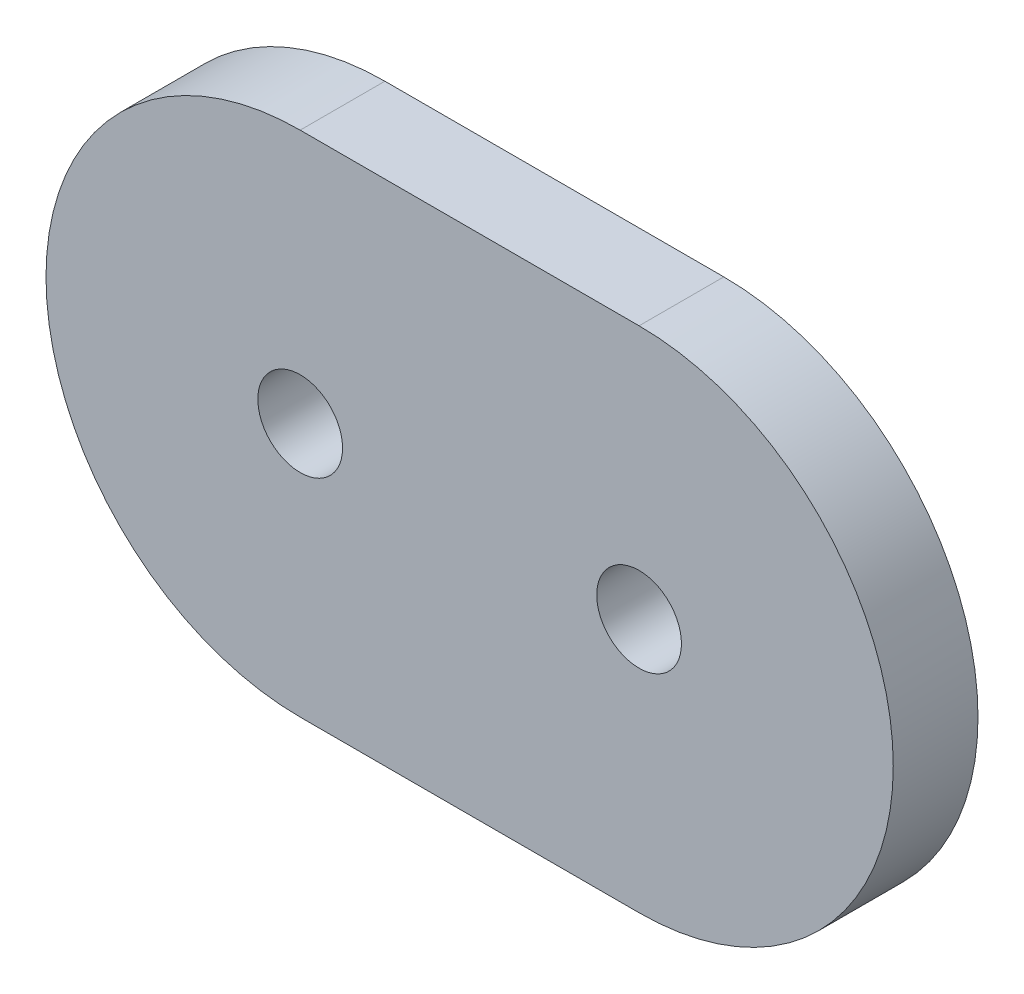
from build123d import *

# Parameters (mm, degrees)
SKETCH1_R           = 0.25
BOSS_EXTRUDE1_DEPTH = 0.5


with BuildPart() as part:
    # Sketch1 → Boss-Extrude1 (new body)
    with BuildSketch(Plane.XY):
        with BuildLine():
            Line((-4.35483871, 1.5), (-2.35483871, 1.5))
            ThreePointArc((-2.35483871, 1.5), (-0.85483871, 0), (-2.35483871, -1.5))
            Line((-2.35483871, -1.5), (-4.35483871, -1.5))
            ThreePointArc((-4.35483871, -1.5), (-5.85483871, 0), (-4.35483871, 1.5))
        make_face()
        with Locations((-4.35483871, 0)):
            Circle(SKETCH1_R, mode=Mode.SUBTRACT)
        with Locations((-2.35483871, 0)):
            Circle(SKETCH1_R, mode=Mode.SUBTRACT)
    extrude(amount=BOSS_EXTRUDE1_DEPTH)


solid = part.part
